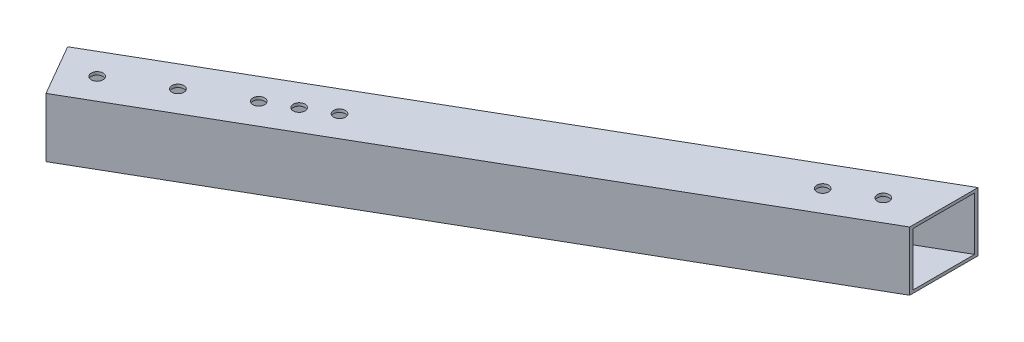
from build123d import *

# Parameters (mm, degrees)
SKETCH_1_R          = 2
EXTRUDE_1_DEPTH     = 20
SKETCH_2_W          = 18
SKETCH_2_H          = 18
CUT_EXTRUDE_1_DEPTH = 227.406099505


with BuildPart() as part:
    # 草图1 → 凸台-拉伸1 (new body)
    with BuildSketch(Plane(origin=(0, 0, 0), x_dir=(1, 0, 0), z_dir=(0, 1, 0))):
        Polygon((98.036220612, 64.925160964), (98.036220612, 41.831150196), (-87.17089272, -65.098226542), (-97.17089272, -47.777718466), align=None)
        with Locations(Location((-83.481517274, -51.486680212, 0), (0, 0, 270))):
            Circle(SKETCH_1_R, mode=Mode.SUBTRACT)
        with Locations(Location((-66.161009198, -41.486680212, 0), (0, 0, 270))):
            Circle(SKETCH_1_R, mode=Mode.SUBTRACT)
        with Locations(Location((-48.86962253, -31.437972504, 0), (0, 0, 270))):
            Circle(SKETCH_1_R, mode=Mode.SUBTRACT)
        with Locations(Location((-40.209368493, -26.437972504, 0), (0, 0, 270))):
            Circle(SKETCH_1_R, mode=Mode.SUBTRACT)
        with Locations(Location((-31.549114455, -21.437972504, 0), (0, 0, 270))):
            Circle(SKETCH_1_R, mode=Mode.SUBTRACT)
        with Locations(Location((72.055458499, 38.37815558, 0), (0, 0, 270))):
            Circle(SKETCH_1_R, mode=Mode.SUBTRACT)
        with Locations(Location((85.045839556, 45.87815558, 0), (0, 0, 270))):
            Circle(SKETCH_1_R, mode=Mode.SUBTRACT)
    extrude(amount=EXTRUDE_1_DEPTH)

    # 草图2 → 切除-拉伸1 (cut, through all)
    with BuildSketch(Plane(origin=(-93.566528503, 0, 54.020660418), x_dir=(0.500000000000001, 0, 0.8660254037844382), z_dir=(-0.866025403784438, 0, 0.5000000000000009))):
        with Locations((2.791271567, 10)):
            Rectangle(SKETCH_2_W, SKETCH_2_H)
    extrude(amount=-CUT_EXTRUDE_1_DEPTH, mode=Mode.SUBTRACT)


solid = part.part
